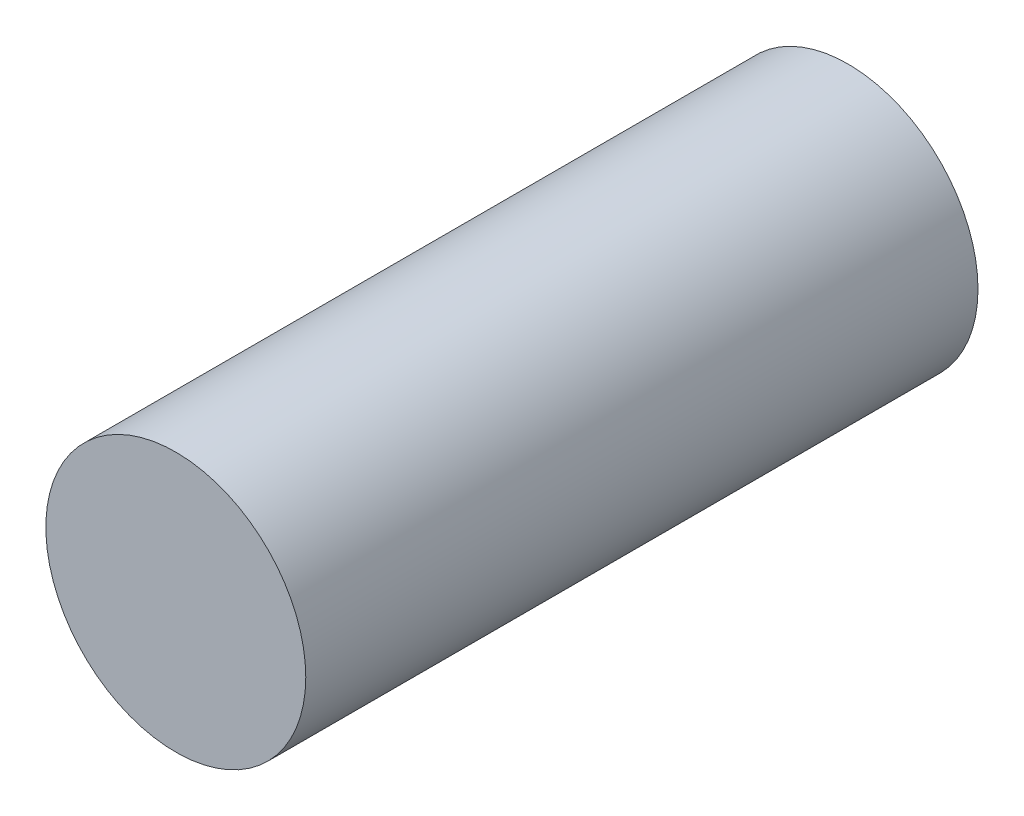
from build123d import *

# Parameters (mm, degrees)
SKETCH_1_R      = 58
SKETCH_1_R_2    = 55.5
EXTRUDE_1_DEPTH = 150
SKETCH_2_R      = 58
EXTRUDE_2_DEPTH = 10


with BuildPart() as part:
    # Эскиз1 → Бобышка-Вытянуть1 (new, symmetric)
    with BuildSketch(Plane.XY):
        Circle(SKETCH_1_R)
        Circle(SKETCH_1_R_2, mode=Mode.SUBTRACT)
    extrude(amount=EXTRUDE_1_DEPTH, both=True)

    # Эскиз2 → Бобышка-Вытянуть2 (add)
    with BuildSketch(Plane.XY.offset(150)):
        Circle(SKETCH_2_R)
    extrude(amount=-EXTRUDE_2_DEPTH)


solid = part.part
